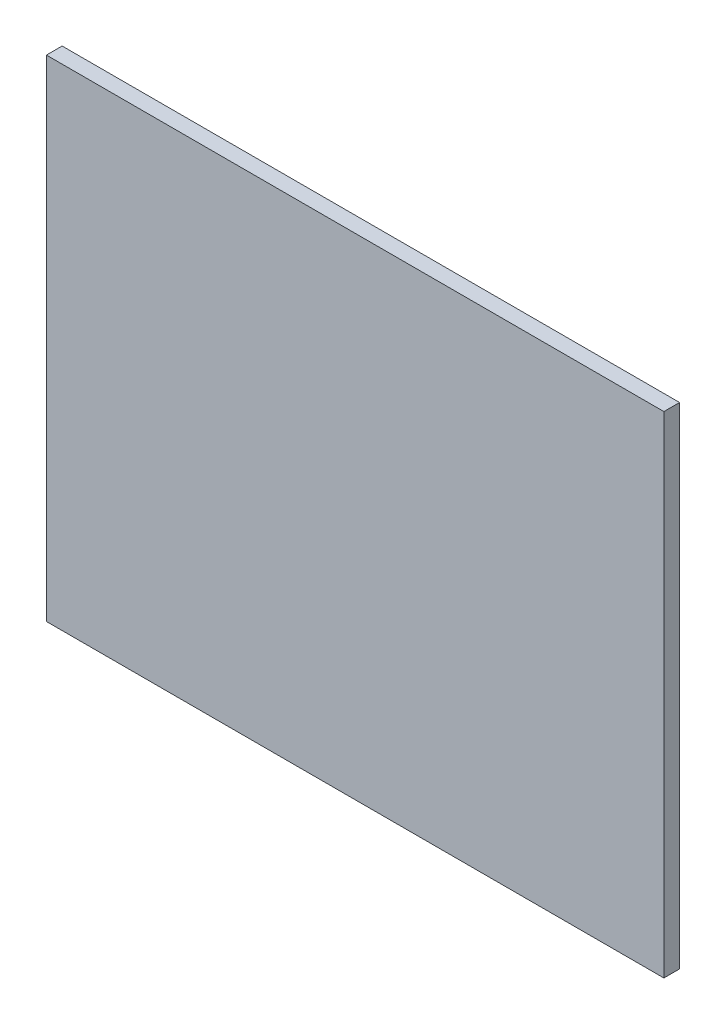
from build123d import *

# Parameters (mm, degrees)
CROQUIS1_W              = 472
CROQUIS1_H              = 375
SALIENTE_EXTRUIR1_DEPTH = 6
CROQUIS2_R              = 3
CORTAR_EXTRUIR1_DEPTH   = 12


with BuildPart() as part:
    # Croquis1 → Saliente-Extruir1 (new, symmetric)
    with BuildSketch(Plane.XY):
        Rectangle(CROQUIS1_W, CROQUIS1_H)
    extrude(amount=SALIENTE_EXTRUIR1_DEPTH, both=True)

    # Croquis2 → Cortar-Extruir1 (cut)
    with BuildSketch(Plane.XY):
        with Locations((-230, 70)):
            Circle(CROQUIS2_R)
        with Locations((-230, 140)):
            Circle(CROQUIS2_R)
        with Locations((-182.712951509, 181.5)):
            Circle(CROQUIS2_R)
        with Locations((-92.712951509, 181.5)):
            Circle(CROQUIS2_R)
        with Locations(Location((92.712951509, 181.5, 0), (0, 0, 180))):
            Circle(CROQUIS2_R)
        with Locations(Location((182.712951509, 181.5, 0), (0, 0, 180))):
            Circle(CROQUIS2_R)
        with Locations(Location((-230, -140, 0), (0, 0, 180))):
            Circle(CROQUIS2_R)
        with Locations(Location((-230, -70, 0), (0, 0, 180))):
            Circle(CROQUIS2_R)
        with Locations((230, -140)):
            Circle(CROQUIS2_R)
        with Locations((230, -70)):
            Circle(CROQUIS2_R)
        with Locations(Location((230, 70, 0), (0, 0, 180))):
            Circle(CROQUIS2_R)
        with Locations(Location((230, 140, 0), (0, 0, 180))):
            Circle(CROQUIS2_R)
    extrude(amount=-CORTAR_EXTRUIR1_DEPTH, mode=Mode.SUBTRACT)


solid = part.part
